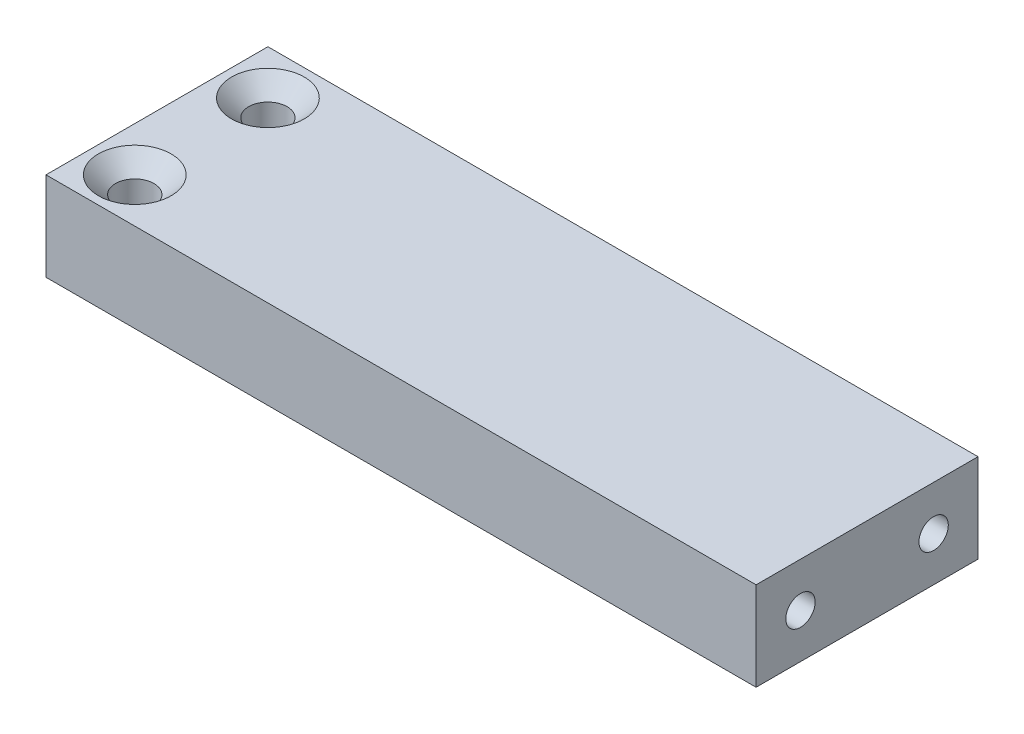
from build123d import *

# Parameters (mm, degrees)
SKETCH1_W                                       = 101.6
SKETCH1_H                                       = 31.75
BOSS_EXTRUDE1_DEPTH                             = 6.35
M5X0_8_TAPPED_HOLE1_D                           = 4.2
M5X0_8_TAPPED_HOLE1_DEPTH                       = 10.9301927
M5X0_8_TAPPED_HOLE1_TIP                         = 1.2618073
CSK_FOR_M5_FLAT_HEAD_MACHINE_SCREW1_D           = 5.5
CSK_FOR_M5_FLAT_HEAD_MACHINE_SCREW1_DEPTH       = 10.539633298
CSK_FOR_M5_FLAT_HEAD_MACHINE_SCREW1_CSINK_D     = 10.4
CSK_FOR_M5_FLAT_HEAD_MACHINE_SCREW1_CSINK_ANGLE = 90
CSK_FOR_M5_FLAT_HEAD_MACHINE_SCREW1_TIP         = 1.652366702


with BuildPart() as part:
    # Sketch1 → Boss-Extrude1 (new, symmetric)
    with BuildSketch(Plane(origin=(0, 0, 0), x_dir=(1, 0, 0), z_dir=(0, 1, 0))):
        Rectangle(SKETCH1_W, SKETCH1_H)
    extrude(amount=BOSS_EXTRUDE1_DEPTH, both=True)

    # M5x0.8 Tapped Hole1
    with Locations(Plane(origin=(50.8, 0, 0), x_dir=(0, 0, -1), z_dir=(1, 0, 0))):
        with Locations((-9.525, 0), (9.525, 0)):
            Hole(M5X0_8_TAPPED_HOLE1_D / 2, depth=M5X0_8_TAPPED_HOLE1_DEPTH)
            with Locations((0, 0, -(M5X0_8_TAPPED_HOLE1_DEPTH + M5X0_8_TAPPED_HOLE1_TIP / 2))):  # 118° drill point
                Cone(0, M5X0_8_TAPPED_HOLE1_D / 2, M5X0_8_TAPPED_HOLE1_TIP, mode=Mode.SUBTRACT)

    # CSK for M5 Flat Head Machine Screw1
    with Locations(Plane(origin=(0, 6.35, 0), x_dir=(1, 0, 0), z_dir=(0, 1, 0))):
        with Locations((-44.45, -9.525), (-44.45, 9.525)):
            CounterSinkHole(CSK_FOR_M5_FLAT_HEAD_MACHINE_SCREW1_D / 2, CSK_FOR_M5_FLAT_HEAD_MACHINE_SCREW1_CSINK_D / 2, depth=CSK_FOR_M5_FLAT_HEAD_MACHINE_SCREW1_DEPTH, counter_sink_angle=CSK_FOR_M5_FLAT_HEAD_MACHINE_SCREW1_CSINK_ANGLE)
            with Locations((0, 0, -(CSK_FOR_M5_FLAT_HEAD_MACHINE_SCREW1_DEPTH + CSK_FOR_M5_FLAT_HEAD_MACHINE_SCREW1_TIP / 2))):  # 118° drill point
                Cone(0, CSK_FOR_M5_FLAT_HEAD_MACHINE_SCREW1_D / 2, CSK_FOR_M5_FLAT_HEAD_MACHINE_SCREW1_TIP, mode=Mode.SUBTRACT)


solid = part.part
